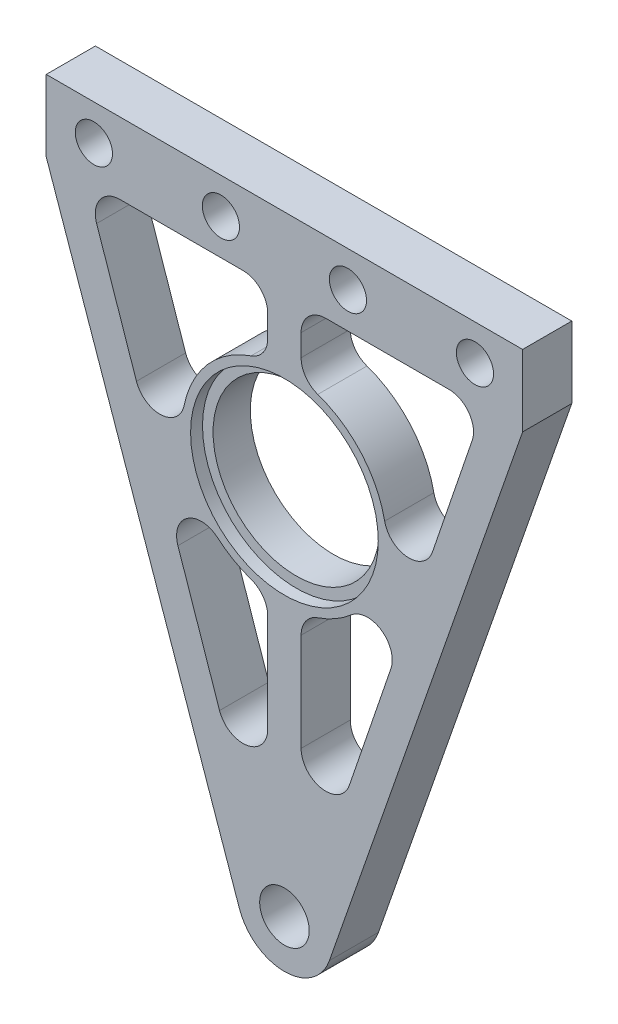
from build123d import *

# Parameters (mm, degrees)
BOSS_EXTRUDE1_DEPTH     = 6.5532
CUT_EXTRUDE1_DEPTH      = 94.204461666
CUT_EXTRUDE2_DEPTH      = 94.204461666
CUT_EXTRUDE3_DEPTH      = 94.204461666
CUT_EXTRUDE4_DEPTH      = 94.204461666
F_1_4_CLEARANCE_HOLE1_D = 6.604
HOLE1_D                 = 4.953
HOLE2_D                 = 22.1996
HOLE2_CBORE_D           = 25.019
HOLE2_CBORE_DEPTH       = 1.5875
FILLET1_R               = 3.302


with BuildPart() as part:
    # Sketch1 → Boss-Extrude1 (new body)
    with BuildSketch(Plane.XY.offset(6.5532)):
        with BuildLine():
            Line((24.389857327, -74.032249917), (50.14347414, -0.124279011))
            Line((50.14347414, -0.124279011), (50.14347414, 9.400720989))
            Line((50.14347414, 9.400720989), (-13.35652586, 9.400720989))
            Line((-13.35652586, 9.400720989), (-13.35652586, -0.124279011))
            Line((-13.35652586, -0.124279011), (12.397090952, -74.032249917))
            ThreePointArc((12.397090952, -74.032249917), (18.39347414, -78.292779011), (24.389857327, -74.032249917))
        make_face()
    extrude(amount=-BOSS_EXTRUDE1_DEPTH)

    # Sketch2 → Cut-Extrude1 (cut, through all)
    with BuildSketch(Plane.XY.offset(6.5532)):
        with BuildLine():
            Line((20.61597414, -35.794091329), (20.61597414, -51.420905267))
            ThreePointArc((20.61597414, -51.420905267), (23.377652776, -54.67839768), (27.043143627, -52.486982035))
            Line((27.043143627, -52.486982035), (32.590050314, -36.226404888))
            ThreePointArc((32.590050314, -36.226404888), (31.312054869, -32.423331215), (27.307035446, -32.660946735))
            ThreePointArc((27.307035446, -32.660946735), (24.177686628, -34.689191283), (20.61597414, -35.794091329))
        make_face()
    extrude(amount=-CUT_EXTRUDE1_DEPTH, mode=Mode.SUBTRACT)

    # Sketch3 → Cut-Extrude2 (cut, through all)
    with BuildSketch(Plane.XY.offset(6.5532)):
        with BuildLine():
            Line((16.17097414, -51.420905267), (16.17097414, -35.794091329))
            ThreePointArc((16.17097414, -35.794091329), (12.609261651, -34.689191283), (9.479912834, -32.660946735))
            ThreePointArc((9.479912834, -32.660946735), (5.47489341, -32.423331215), (4.196897965, -36.226404888))
            Line((4.196897965, -36.226404888), (9.743804652, -52.486982035))
            ThreePointArc((9.743804652, -52.486982035), (13.409295504, -54.67839768), (16.17097414, -51.420905267))
        make_face()
    extrude(amount=-CUT_EXTRUDE2_DEPTH, mode=Mode.SUBTRACT)

    # Sketch4 → Cut-Extrude3 (cut, through all)
    with BuildSketch(Plane.XY.offset(6.5532)):
        with BuildLine():
            Line((38.119000553, -20.018466488), (43.427416008, -4.457018658))
            ThreePointArc((43.427416008, -4.457018658), (42.991263585, -1.493779513), (40.327528698, -0.124279011))
            Line((40.327528698, -0.124279011), (20.61597414, -0.124279011))
            Line((20.61597414, -0.124279011), (20.61597414, -8.879066693))
            ThreePointArc((20.61597414, -8.879066693), (27.856065704, -12.512959264), (31.758379191, -19.611976838))
            ThreePointArc((31.758379191, -19.611976838), (34.783239019, -22.2476674), (38.119000553, -20.018466488))
        make_face()
    extrude(amount=-CUT_EXTRUDE3_DEPTH, mode=Mode.SUBTRACT)

    # Sketch5 → Cut-Extrude4 (cut, through all)
    with BuildSketch(Plane(origin=(0, 0, 0), x_dir=(-1, 0, 0), z_dir=(0, 0, -1))):
        with BuildLine():
            Line((1.332052274, -20.018466488), (6.640467729, -4.457018658))
            ThreePointArc((6.640467729, -4.457018658), (6.204315306, -1.493779513), (3.540580419, -0.124279011))
            Line((3.540580419, -0.124279011), (-16.17097414, -0.124279011))
            Line((-16.17097414, -0.124279011), (-16.17097414, -8.879066693))
            ThreePointArc((-16.17097414, -8.879066693), (-8.930882576, -12.512959264), (-5.028569088, -19.611976838))
            ThreePointArc((-5.028569088, -19.611976838), (-2.00370926, -22.2476674), (1.332052274, -20.018466488))
        make_face()
    extrude(amount=-CUT_EXTRUDE4_DEPTH, mode=Mode.SUBTRACT)

    # 1/4 Clearance Hole1 (through all)
    with Locations(Plane(origin=(0, 0, 0), x_dir=(-1, 0, 0), z_dir=(0, 0, -1))):
        with Locations((-18.39347414, -71.942579011)):
            Hole(F_1_4_CLEARANCE_HOLE1_D / 2)

    # Hole1 (through all)
    with Locations(Plane.XY.offset(6.5532)):
        with Locations((9.92765366, 4.638220989), (26.85929426, 4.638220989), (-7.00652586, 4.638220989), (43.79347426, 4.638220989)):
            Hole(HOLE1_D / 2)

    # Hole2 (through all)
    with Locations(Plane.XY.offset(6.5532)):
        with Locations((18.39347414, -22.336579011)):
            CounterBoreHole(HOLE2_D / 2, HOLE2_CBORE_D / 2, HOLE2_CBORE_DEPTH)

    # Fillet1
    fillet1_edges = [part.edges().sort_by_distance(p)[0] for p in [
        (20.61597414, -35.794091329, 3.2766),
        (16.17097414, -35.794091329, 3.2766),
        (20.61597414, -8.879066693, 3.2766),
        (20.61597414, -0.124279011, 3.2766),
        (16.17097414, -8.879066693, 3.2766),
        (16.17097414, -0.124279011, 3.2766),
    ]]
    fillet(fillet1_edges, radius=FILLET1_R)


solid = part.part
